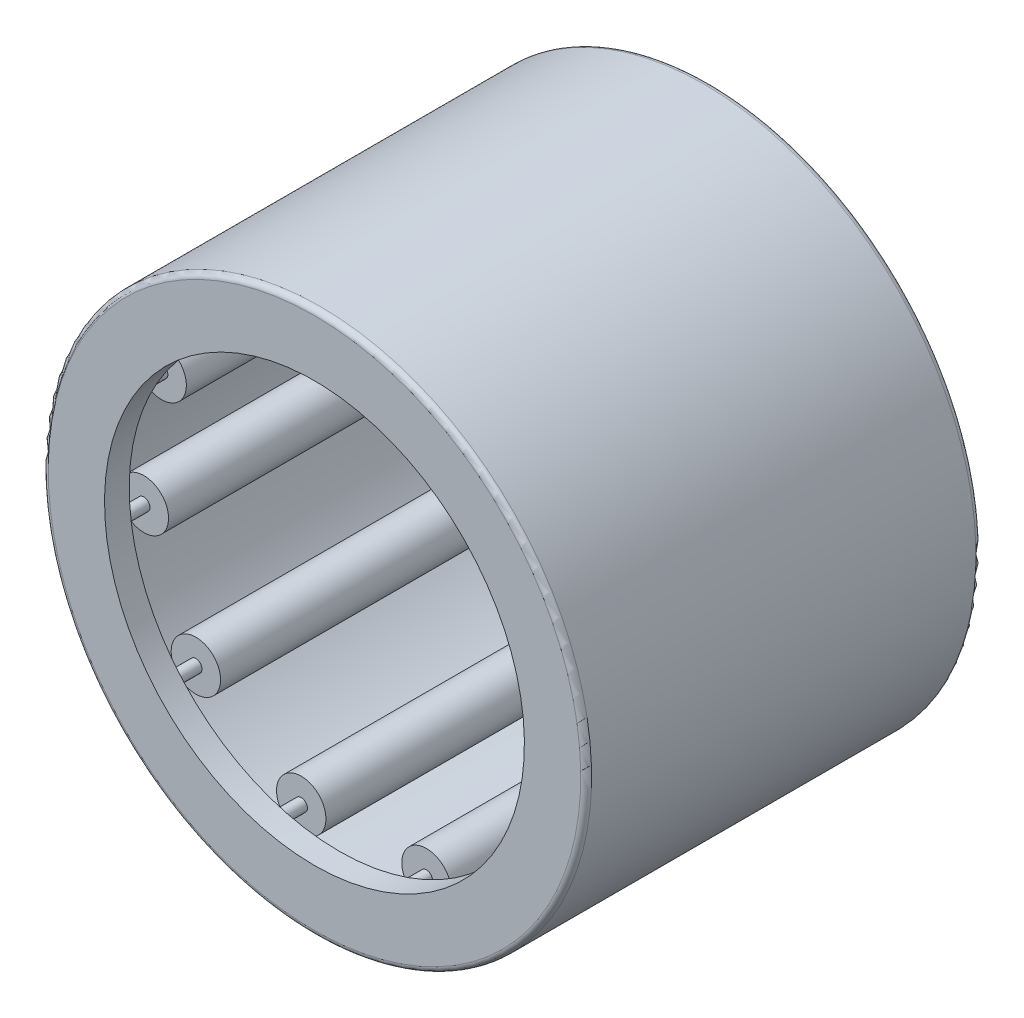
from build123d import *

# Parameters (mm, degrees)
SKETCH2_W         = 9.525
SKETCH2_H         = 0.5953125
SKETCH3_W         = 11.1125
SKETCH3_H         = 0.1984375
CIRPATTERN1_COUNT = 11
CIRPATTERN1_ANGLE = 327.272727273
FILLET1_R         = 0.174625


with BuildPart() as part:
    # Sketch1 → Revolve1 (revolve)
    with BuildSketch(Plane(origin=(0, 0, 0), x_dir=(0, 0, -1), z_dir=(1, 0, 0))):
        Polygon((-6.35, 8.73125), (6.35, 8.73125), (6.35, 6.746875), (5.55625, 6.746875), (5.55625, 7.9375), (-5.55625, 7.9375), (-5.55625, 6.746875), (-6.35, 6.746875), align=None)
    revolve(axis=Axis((0, 0, 6.35), (0, 0, -1)))

    # Fillet1
    fillet1_edges = [part.edges().sort_by_distance(p)[0] for p in [
        (0, -8.73125, -6.35),
        (0, -8.73125, 6.35),
    ]]
    fillet(fillet1_edges, radius=FILLET1_R)


with BuildPart() as body_2:
    # Sketch2 → Revolve2 (revolve)
    with BuildSketch(Plane(origin=(0, 0, 0), x_dir=(0, 0, -1), z_dir=(1, 0, 0))):
        with Locations((0, 7.63984375)):
            Rectangle(SKETCH2_W, SKETCH2_H)
    revolve(axis=Axis((0, 7.14375, 4.7625), (0, 0, -1)))


with BuildPart() as body_3:
    # Sketch3 → Revolve3 (revolve)
    with BuildSketch(Plane(origin=(0, 0, 0), x_dir=(0, 0, -1), z_dir=(1, 0, 0))):
        with Locations((0, 7.24296875)):
            Rectangle(SKETCH3_W, SKETCH3_H)
    revolve(axis=Axis((0, 7.14375, 5.55625), (0, 0, -1)))


with BuildPart() as cirpattern1_1:
    # CirPattern1: pattern copy
    add(body_2.part.rotate(Axis((0, 0, -6.35), (0, 0, 1)), 1 * CIRPATTERN1_ANGLE / (CIRPATTERN1_COUNT - 1)))


with BuildPart() as cirpattern1_2:
    # CirPattern1: pattern copy
    add(body_2.part.rotate(Axis((0, 0, -6.35), (0, 0, 1)), 2 * CIRPATTERN1_ANGLE / (CIRPATTERN1_COUNT - 1)))


with BuildPart() as cirpattern1_3:
    # CirPattern1: pattern copy
    add(body_2.part.rotate(Axis((0, 0, -6.35), (0, 0, 1)), 3 * CIRPATTERN1_ANGLE / (CIRPATTERN1_COUNT - 1)))


with BuildPart() as cirpattern1_4:
    # CirPattern1: pattern copy
    add(body_2.part.rotate(Axis((0, 0, -6.35), (0, 0, 1)), 4 * CIRPATTERN1_ANGLE / (CIRPATTERN1_COUNT - 1)))


with BuildPart() as cirpattern1_5:
    # CirPattern1: pattern copy
    add(body_2.part.rotate(Axis((0, 0, -6.35), (0, 0, 1)), 5 * CIRPATTERN1_ANGLE / (CIRPATTERN1_COUNT - 1)))


with BuildPart() as cirpattern1_6:
    # CirPattern1: pattern copy
    add(body_2.part.rotate(Axis((0, 0, -6.35), (0, 0, 1)), 6 * CIRPATTERN1_ANGLE / (CIRPATTERN1_COUNT - 1)))


with BuildPart() as cirpattern1_7:
    # CirPattern1: pattern copy
    add(body_2.part.rotate(Axis((0, 0, -6.35), (0, 0, 1)), 7 * CIRPATTERN1_ANGLE / (CIRPATTERN1_COUNT - 1)))


with BuildPart() as cirpattern1_8:
    # CirPattern1: pattern copy
    add(body_2.part.rotate(Axis((0, 0, -6.35), (0, 0, 1)), 8 * CIRPATTERN1_ANGLE / (CIRPATTERN1_COUNT - 1)))


with BuildPart() as cirpattern1_9:
    # CirPattern1: pattern copy
    add(body_2.part.rotate(Axis((0, 0, -6.35), (0, 0, 1)), 9 * CIRPATTERN1_ANGLE / (CIRPATTERN1_COUNT - 1)))


with BuildPart() as cirpattern1_10:
    # CirPattern1: pattern copy
    add(body_2.part.rotate(Axis((0, 0, -6.35), (0, 0, 1)), 10 * CIRPATTERN1_ANGLE / (CIRPATTERN1_COUNT - 1)))


with BuildPart() as cirpattern1_11:
    # CirPattern1: pattern copy
    add(body_3.part.rotate(Axis((0, 0, -6.35), (0, 0, 1)), 1 * CIRPATTERN1_ANGLE / (CIRPATTERN1_COUNT - 1)))


with BuildPart() as cirpattern1_12:
    # CirPattern1: pattern copy
    add(body_3.part.rotate(Axis((0, 0, -6.35), (0, 0, 1)), 2 * CIRPATTERN1_ANGLE / (CIRPATTERN1_COUNT - 1)))


with BuildPart() as cirpattern1_13:
    # CirPattern1: pattern copy
    add(body_3.part.rotate(Axis((0, 0, -6.35), (0, 0, 1)), 3 * CIRPATTERN1_ANGLE / (CIRPATTERN1_COUNT - 1)))


with BuildPart() as cirpattern1_14:
    # CirPattern1: pattern copy
    add(body_3.part.rotate(Axis((0, 0, -6.35), (0, 0, 1)), 4 * CIRPATTERN1_ANGLE / (CIRPATTERN1_COUNT - 1)))


with BuildPart() as cirpattern1_15:
    # CirPattern1: pattern copy
    add(body_3.part.rotate(Axis((0, 0, -6.35), (0, 0, 1)), 5 * CIRPATTERN1_ANGLE / (CIRPATTERN1_COUNT - 1)))


with BuildPart() as cirpattern1_16:
    # CirPattern1: pattern copy
    add(body_3.part.rotate(Axis((0, 0, -6.35), (0, 0, 1)), 6 * CIRPATTERN1_ANGLE / (CIRPATTERN1_COUNT - 1)))


with BuildPart() as cirpattern1_17:
    # CirPattern1: pattern copy
    add(body_3.part.rotate(Axis((0, 0, -6.35), (0, 0, 1)), 7 * CIRPATTERN1_ANGLE / (CIRPATTERN1_COUNT - 1)))


with BuildPart() as cirpattern1_18:
    # CirPattern1: pattern copy
    add(body_3.part.rotate(Axis((0, 0, -6.35), (0, 0, 1)), 8 * CIRPATTERN1_ANGLE / (CIRPATTERN1_COUNT - 1)))


with BuildPart() as cirpattern1_19:
    # CirPattern1: pattern copy
    add(body_3.part.rotate(Axis((0, 0, -6.35), (0, 0, 1)), 9 * CIRPATTERN1_ANGLE / (CIRPATTERN1_COUNT - 1)))


with BuildPart() as cirpattern1_20:
    # CirPattern1: pattern copy
    add(body_3.part.rotate(Axis((0, 0, -6.35), (0, 0, 1)), 10 * CIRPATTERN1_ANGLE / (CIRPATTERN1_COUNT - 1)))


solid = Compound([part.part, body_2.part, body_3.part, cirpattern1_1.part, cirpattern1_2.part, cirpattern1_3.part, cirpattern1_4.part, cirpattern1_5.part, cirpattern1_6.part, cirpattern1_7.part, cirpattern1_8.part, cirpattern1_9.part, cirpattern1_10.part, cirpattern1_11.part, cirpattern1_12.part, cirpattern1_13.part, cirpattern1_14.part, cirpattern1_15.part, cirpattern1_16.part, cirpattern1_17.part, cirpattern1_18.part, cirpattern1_19.part, cirpattern1_20.part])
